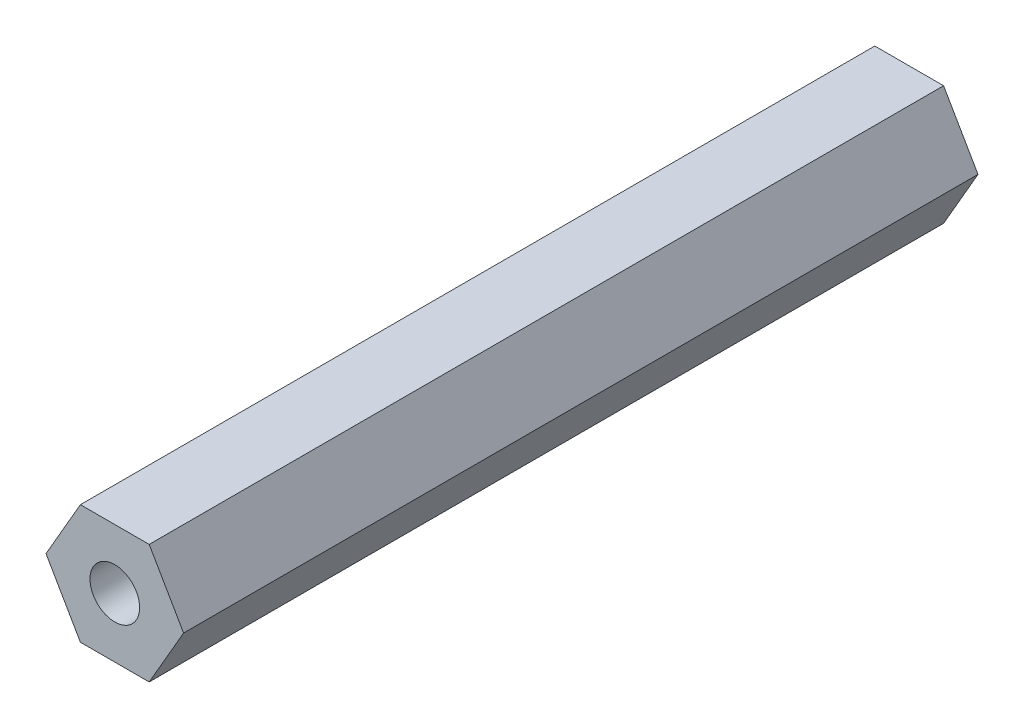
from build123d import *

# Parameters (mm, degrees)
BOSS_EXTRUDE1_DEPTH = 40
SKETCH2_R           = 1.25
CUT_EXTRUDE1_DEPTH  = 41.261644278


with BuildPart() as part:
    # Sketch1 → Boss-Extrude1 (new body)
    with BuildSketch(Plane.XY):
        Polygon((3.464101615, 0), (1.732050808, 3), (-1.732050808, 3), (-3.464101615, 0), (-1.732050808, -3), (1.732050808, -3), align=None)
    extrude(amount=-BOSS_EXTRUDE1_DEPTH)

    # Sketch2 → Cut-Extrude1 (cut, through all)
    with BuildSketch(Plane.XY):
        Circle(SKETCH2_R)
    extrude(amount=-CUT_EXTRUDE1_DEPTH, mode=Mode.SUBTRACT)


solid = part.part
